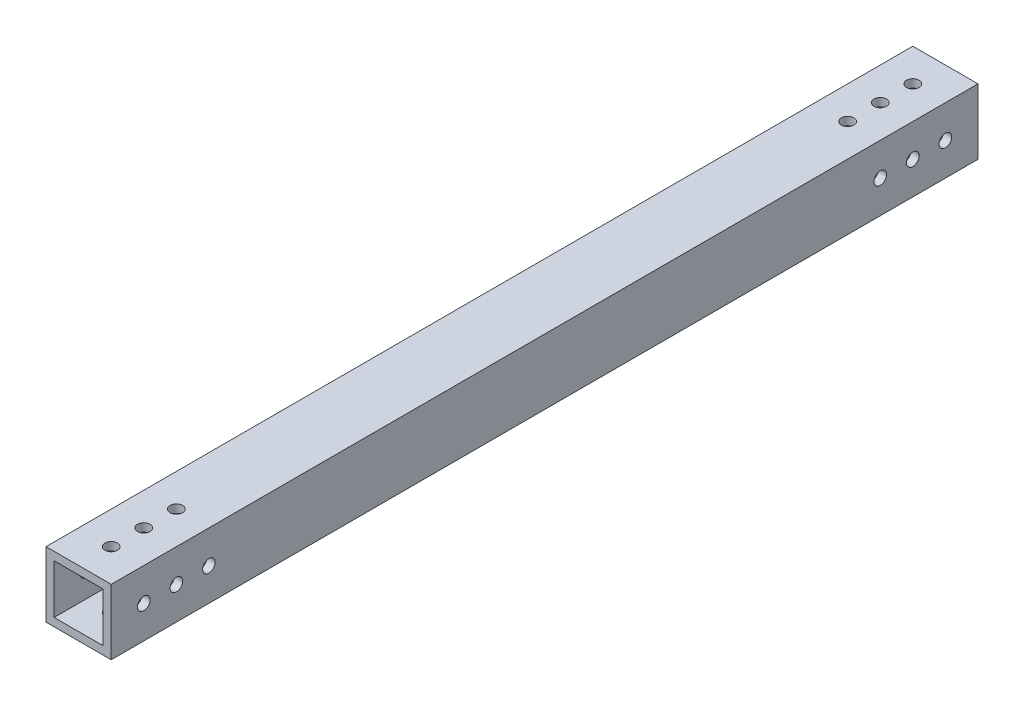
from build123d import *

# Parameters (mm, degrees)
SKETCH1_W                    = 25.4
SKETCH1_H                    = 25.475595238
SKETCH1_W_2                  = 19.05
SKETCH1_H_2                  = 19.125595238
EXTRUDE_THIN1_DEPTH          = 337.82
F_10_0_1935_DIAMETER_HOLE1_D = 4.9149
F_10_0_1935_DIAMETER_HOLE2_D = 4.9149


with BuildPart() as part:
    # Sketch1 → Extrude-Thin1 (new body)
    with BuildSketch(Plane.XY):
        with Locations((-12.7, 12.737797619)):
            Rectangle(SKETCH1_W, SKETCH1_H)
        with Locations((-12.7, 12.737797619)):
            Rectangle(SKETCH1_W_2, SKETCH1_H_2, mode=Mode.SUBTRACT)
    extrude(amount=EXTRUDE_THIN1_DEPTH)

    # #10 (0.1935) Diameter Hole1 (through all)
    with Locations(Plane(origin=(0, 0, 0), x_dir=(-1, 0, 0), z_dir=(0, -1, 0))):
        with Locations((12.7, -25.4), (12.7, -12.7), (12.7, -38.1), (12.7, -299.72), (12.7, -312.42), (12.7, -325.12)):
            Hole(F_10_0_1935_DIAMETER_HOLE1_D / 2)

    # #10 (0.1935) Diameter Hole2 (through all)
    with Locations(Plane.ZY.offset(25.4)):
        with Locations((325.12, 12.666654514), (312.42, 12.666654514), (299.72, 12.666654514), (38.1, 12.7), (25.4, 12.7), (12.7, 12.7)):
            Hole(F_10_0_1935_DIAMETER_HOLE2_D / 2)


solid = part.part
